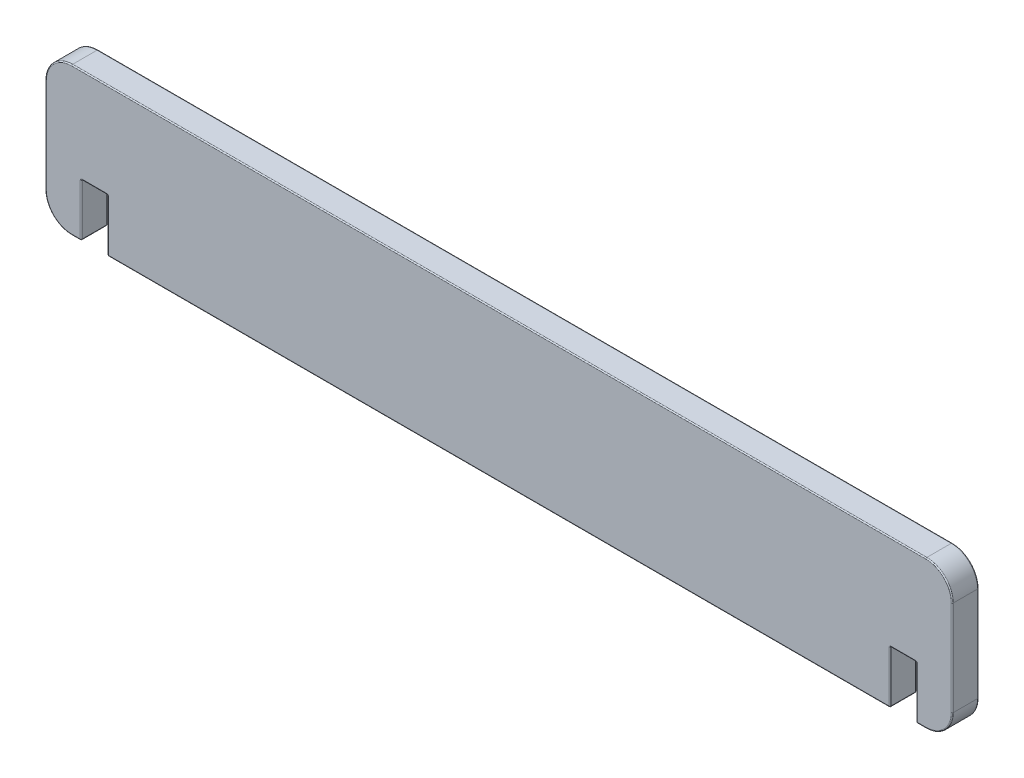
from build123d import *

# Parameters (mm, degrees)
RESSALTO_EXTRUS_O1_DEPTH = 2.5
FILETE1_R                = 0.1


with BuildPart() as part:
    # Esboço1 → Ressalto-extrusão1 (new body)
    with BuildSketch(Plane.XY):
        with BuildLine():
            Line((-12.454787307, 163.73471538), (-93.454787307, 163.73471538))
            ThreePointArc((-93.454787307, 163.73471538), (-95.22255426, 163.002482333), (-95.954787307, 161.23471538))
            Line((-95.954787307, 161.23471538), (-95.954787307, 152.23471538))
            ThreePointArc((-95.954787307, 152.23471538), (-95.22255426, 150.466948427), (-93.454787307, 149.73471538))
            Line((-93.454787307, 149.73471538), (-92.554787307, 149.73471538))
            Line((-92.554787307, 149.73471538), (-92.554787307, 154.73471538))
            Line((-92.554787307, 154.73471538), (-90.054787307, 154.73471538))
            Line((-90.054787307, 154.73471538), (-90.054787307, 149.73471538))
            Line((-90.054787307, 149.73471538), (-66.954787307, 149.73471538))
            Line((-66.954787307, 149.73471538), (-64.454787307, 149.73471538))
            Line((-64.454787307, 149.73471538), (-41.454787307, 149.73471538))
            Line((-41.454787307, 149.73471538), (-38.954787307, 149.73471538))
            Line((-38.954787307, 149.73471538), (-15.854787307, 149.73471538))
            Line((-15.854787307, 149.73471538), (-15.854787307, 154.73471538))
            Line((-15.854787307, 154.73471538), (-13.354787307, 154.73471538))
            Line((-13.354787307, 154.73471538), (-13.354787307, 149.73471538))
            Line((-13.354787307, 149.73471538), (-12.454787307, 149.73471538))
            ThreePointArc((-12.454787307, 149.73471538), (-10.687020354, 150.466948427), (-9.954787307, 152.23471538))
            Line((-9.954787307, 152.23471538), (-9.954787307, 161.23471538))
            ThreePointArc((-9.954787307, 161.23471538), (-10.687020354, 163.002482333), (-12.454787307, 163.73471538))
        make_face()
    extrude(amount=RESSALTO_EXTRUS_O1_DEPTH)

    # Filete1
    filete1_edges = [part.edges().sort_by_distance(p)[0] for p in [
        (-93.004787307, 149.73471538, 2.5),
        (-95.22255426, 163.002482333, 0),
        (-52.954787307, 163.73471538, 0),
        (-92.554787307, 152.23471538, 2.5),
        (-10.687020354, 163.002482333, 0),
        (-9.954787307, 156.73471538, 0),
        (-10.687020354, 150.466948427, 0),
        (-12.904787307, 149.73471538, 0),
        (-13.354787307, 152.23471538, 0),
        (-14.604787307, 154.73471538, 0),
        (-15.854787307, 152.23471538, 0),
        (-52.954787307, 149.73471538, 0),
        (-91.304787307, 154.73471538, 2.5),
        (-90.054787307, 152.23471538, 0),
        (-91.304787307, 154.73471538, 0),
        (-92.554787307, 152.23471538, 0),
        (-93.004787307, 149.73471538, 0),
        (-95.22255426, 150.466948427, 0),
        (-95.954787307, 156.73471538, 0),
        (-90.054787307, 152.23471538, 2.5),
        (-52.954787307, 149.73471538, 2.5),
        (-13.354787307, 149.73471538, 1.25),
        (-13.354787307, 154.73471538, 1.25),
        (-15.854787307, 154.73471538, 1.25),
        (-15.854787307, 149.73471538, 1.25),
        (-90.054787307, 149.73471538, 1.25),
        (-90.054787307, 154.73471538, 1.25),
        (-92.554787307, 154.73471538, 1.25),
        (-92.554787307, 149.73471538, 1.25),
        (-15.854787307, 152.23471538, 2.5),
        (-14.604787307, 154.73471538, 2.5),
        (-13.354787307, 152.23471538, 2.5),
        (-12.904787307, 149.73471538, 2.5),
        (-10.687020354, 150.466948427, 2.5),
        (-95.954787307, 156.73471538, 2.5),
        (-9.954787307, 156.73471538, 2.5),
        (-10.687020354, 163.002482333, 2.5),
        (-52.954787307, 163.73471538, 2.5),
        (-95.22255426, 163.002482333, 2.5),
        (-95.22255426, 150.466948427, 2.5),
    ]]
    fillet(filete1_edges, radius=FILETE1_R)


solid = part.part
